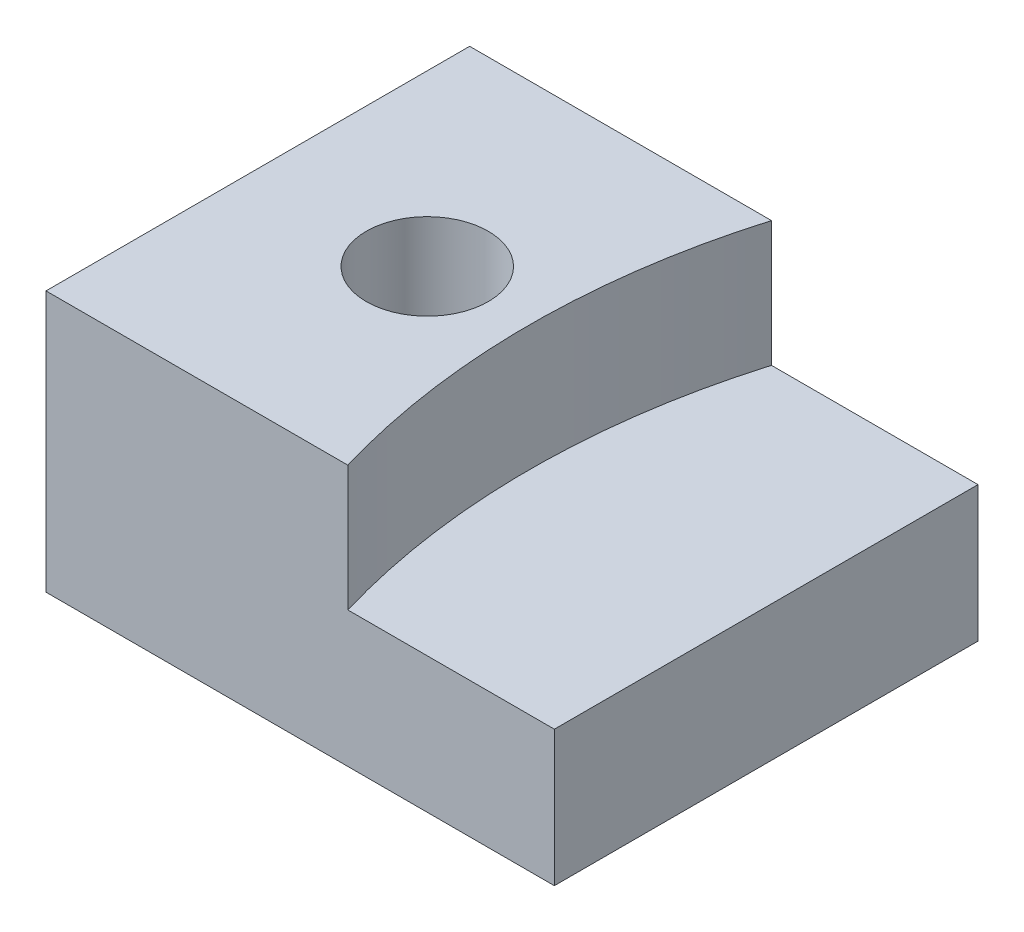
from build123d import *

# Parameters (mm, degrees)
SKETCH3_W           = 7.5
SKETCH3_H           = 6.25
SKETCH3_R           = 0.9
BOSS_EXTRUDE1_DEPTH = 2
SKETCH6_R           = 0.9
BOSS_EXTRUDE3_DEPTH = 1.85


with BuildPart() as part:
    # Sketch3 → Boss-Extrude1 (new body)
    with BuildSketch(Plane(origin=(0, 0, 0), x_dir=(1, 0, 0), z_dir=(0, 1, 0))):
        with Locations((1.25, 0)):
            Rectangle(SKETCH3_W, SKETCH3_H)
        with Locations(Location((0, 0, 0), (0, 0, 270))):
            Circle(SKETCH3_R, mode=Mode.SUBTRACT)
    extrude(amount=BOSS_EXTRUDE1_DEPTH)

    # Sketch6 → Boss-Extrude3 (add)
    with BuildSketch(Plane(origin=(0, 2, 0), x_dir=(1, 0, 0), z_dir=(0, 1, 0))):
        with BuildLine():
            Line((-2.5, 3.125), (-2.5, -3.125))
            Line((-2.5, -3.125), (1.953229167, -3.125))
            ThreePointArc((1.953229167, -3.125), (1.5, 0), (1.953229167, 3.125))
            Line((1.953229167, 3.125), (-2.5, 3.125))
        make_face()
        with Locations(Location((0, 0, 0), (0, 0, 270))):
            Circle(SKETCH6_R, mode=Mode.SUBTRACT)
    extrude(amount=BOSS_EXTRUDE3_DEPTH)


solid = part.part
